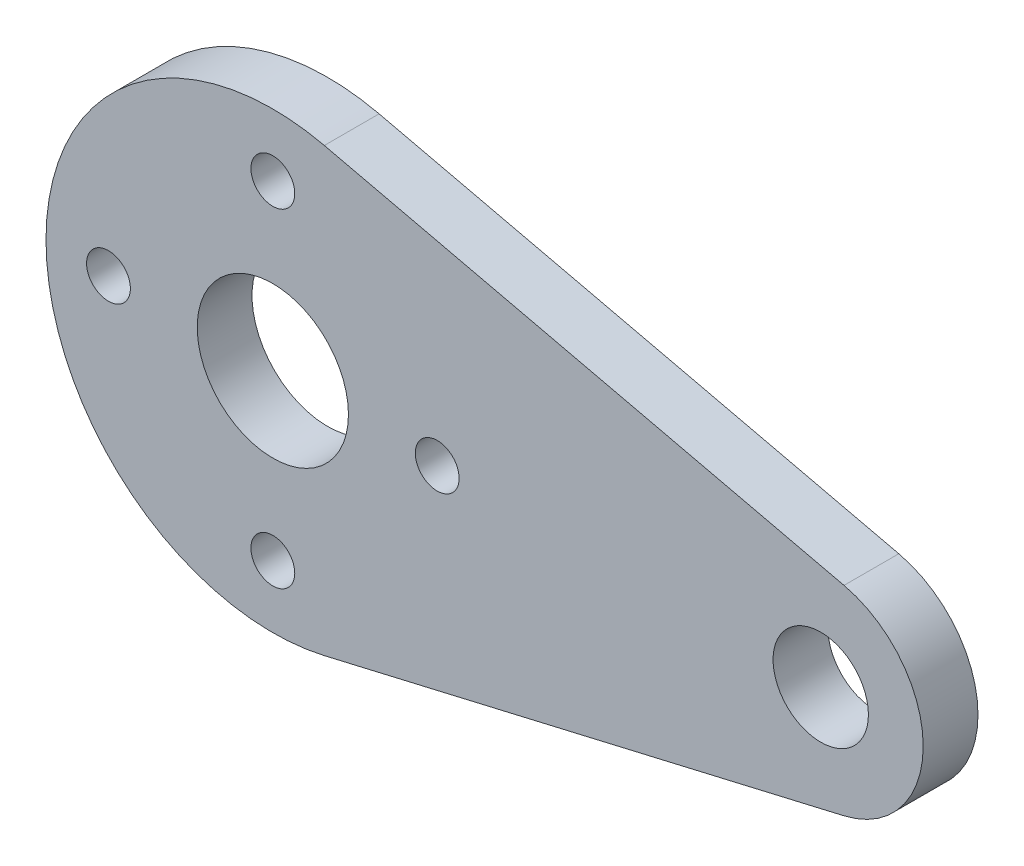
from build123d import *

# Parameters (mm, degrees)
SKETCH1_R           = 6.9
SKETCH1_R_2         = 4.35
SKETCH1_R_3         = 2
BOSS_EXTRUDE1_DEPTH = 5


with BuildPart() as part:
    # Sketch1 → Boss-Extrude1 (new body)
    with BuildSketch(Plane.XY):
        with BuildLine():
            Line((4.6989, 20.159621494), (52.12245, 9.105915989))
            ThreePointArc((52.12245, 9.105915989), (59.35, 0), (52.12245, -9.105915989))
            Line((52.12245, -9.105915989), (4.6989, -20.159621494))
            ThreePointArc((4.6989, -20.159621494), (-20.7, 0), (4.6989, 20.159621494))
        make_face()
        Circle(SKETCH1_R, mode=Mode.SUBTRACT)
        with Locations((50, 0)):
            Circle(SKETCH1_R_2, mode=Mode.SUBTRACT)
        with Locations((15, 0)):
            Circle(SKETCH1_R_3, mode=Mode.SUBTRACT)
        with Locations((0, -15)):
            Circle(SKETCH1_R_3, mode=Mode.SUBTRACT)
        with Locations((-15, 0)):
            Circle(SKETCH1_R_3, mode=Mode.SUBTRACT)
        with Locations((0, 15)):
            Circle(SKETCH1_R_3, mode=Mode.SUBTRACT)
    extrude(amount=BOSS_EXTRUDE1_DEPTH)


solid = part.part
